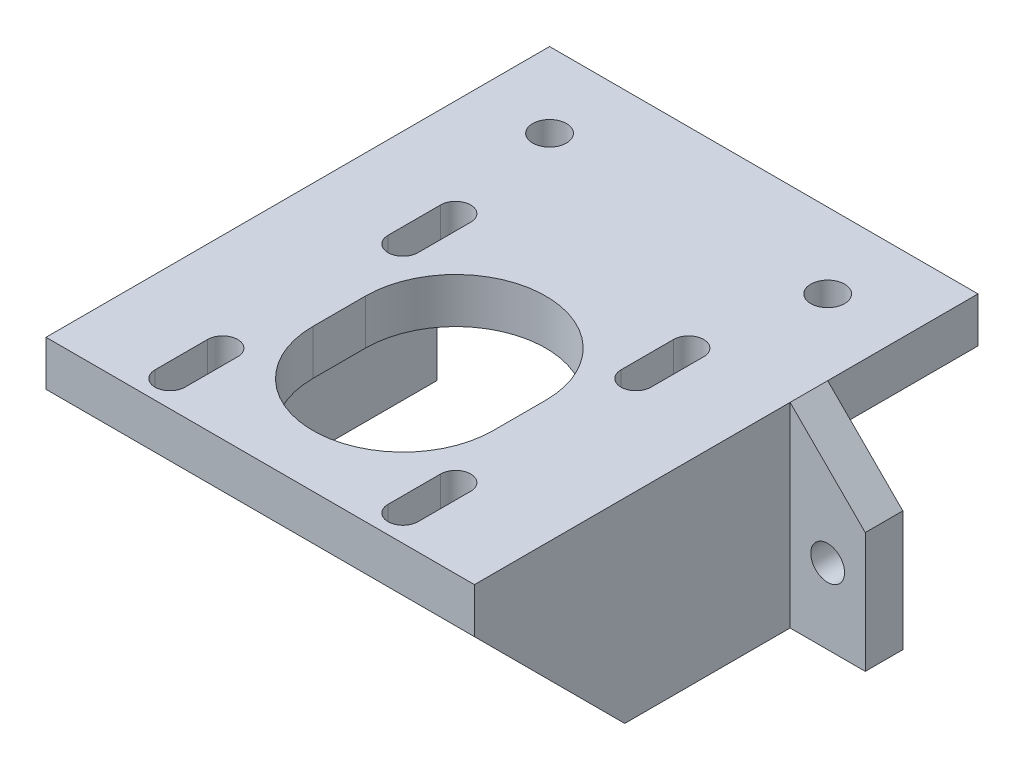
from build123d import *

# Parameters (mm, degrees)
SKETCH1_W           = 57
SKETCH1_H           = 6
BOSS_EXTRUDE1_DEPTH = 50
CUT_EXTRUDE2_DEPTH  = 10
SKETCH4_W           = 57
SKETCH4_H           = 6
BOSS_EXTRUDE2_DEPTH = 17
SKETCH6_R           = 2.25
CUT_EXTRUDE3_DEPTH  = 20
SKETCH8_W           = 5
SKETCH8_H           = 47
BOSS_EXTRUDE4_DEPTH = 20
CHAMFER1_SIZE       = 20
SKETCH9_W           = 5
SKETCH9_H           = 26
BOSS_EXTRUDE5_DEPTH = 10
SKETCH10_W          = 5
SKETCH10_H          = 26
BOSS_EXTRUDE6_DEPTH = 10
CHAMFER2_SIZE       = 10
SKETCH11_R          = 2.25
CUT_EXTRUDE4_DEPTH  = 10


with BuildPart() as part:
    # Sketch1 → Boss-Extrude1 (new body)
    with BuildSketch(Plane.XY):
        Rectangle(SKETCH1_W, SKETCH1_H)
    extrude(amount=BOSS_EXTRUDE1_DEPTH)

    # Sketch3 → Cut-Extrude2 (cut)
    with BuildSketch(Plane(origin=(0, 3, 0), x_dir=(1, 0, 0), z_dir=(0, 1, 0))):
        with BuildLine():
            Line((-13.5, -8.5), (-13.5, -15.5))
            ThreePointArc((-13.5, -15.5), (-15.5, -17.5), (-17.5, -15.5))
            Line((-17.5, -15.5), (-17.5, -8.5))
            ThreePointArc((-17.5, -8.5), (-15.5, -6.5), (-13.5, -8.5))
        make_face()
        with BuildLine():
            Line((-13.5, -39.5), (-13.5, -46.5))
            ThreePointArc((-13.5, -46.5), (-15.5, -48.5), (-17.5, -46.5))
            Line((-17.5, -46.5), (-17.5, -39.5))
            ThreePointArc((-17.5, -39.5), (-15.5, -37.5), (-13.5, -39.5))
        make_face()
        with BuildLine():
            Line((17.5, -39.5), (17.5, -46.5))
            ThreePointArc((17.5, -46.5), (15.5, -48.5), (13.5, -46.5))
            Line((13.5, -46.5), (13.5, -39.5))
            ThreePointArc((13.5, -39.5), (15.5, -37.5), (17.5, -39.5))
        make_face()
        with BuildLine():
            Line((17.5, -8.5), (17.5, -15.5))
            ThreePointArc((17.5, -15.5), (15.5, -17.5), (13.5, -15.5))
            Line((13.5, -15.5), (13.5, -8.5))
            ThreePointArc((13.5, -8.5), (15.5, -6.5), (17.5, -8.5))
        make_face()
        with BuildLine():
            Line((12, -24), (12, -31))
            ThreePointArc((12, -31), (0, -43), (-12, -31))
            Line((-12, -31), (-12, -24))
            ThreePointArc((-12, -24), (0, -12), (12, -24))
        make_face()
    extrude(amount=-CUT_EXTRUDE2_DEPTH, mode=Mode.SUBTRACT)

    # Sketch4 → Boss-Extrude2 (add)
    with BuildSketch(Plane(origin=(0, 0, 0), x_dir=(-1, 0, 0), z_dir=(0, 0, -1))):
        Rectangle(SKETCH4_W, SKETCH4_H)
    extrude(amount=BOSS_EXTRUDE2_DEPTH)

    # Sketch6 → Cut-Extrude3 (cut)
    with BuildSketch(Plane(origin=(0, 3, 0), x_dir=(1, 0, 0), z_dir=(0, 1, 0))):
        with Locations(Location((-18.5, 7, 0), (0, 0, 180))):
            Circle(SKETCH6_R)
        with Locations(Location((18.5, 7, 0), (0, 0, 180))):
            Circle(SKETCH6_R)
    extrude(amount=-CUT_EXTRUDE3_DEPTH, mode=Mode.SUBTRACT)

    # Sketch8 → Boss-Extrude4 (add)
    with BuildSketch(Plane.XZ.offset(3)):
        with Locations((-26, 26.5)):
            Rectangle(SKETCH8_W, SKETCH8_H)
        with Locations((26, 26.5)):
            Rectangle(SKETCH8_W, SKETCH8_H)
    extrude(amount=BOSS_EXTRUDE4_DEPTH)

    # Chamfer1
    chamfer1_edges = [part.edges().sort_by_distance(p)[0] for p in [
        (26, -23, 50),
        (-26, -23, 50),
    ]]
    chamfer(chamfer1_edges, length=CHAMFER1_SIZE)

    # Sketch9 → Boss-Extrude5 (add)
    with BuildSketch(Plane.ZY.offset(28.5)):
        with Locations((5.5, -10)):
            Rectangle(SKETCH9_W, SKETCH9_H)
    extrude(amount=BOSS_EXTRUDE5_DEPTH)

    # Sketch10 → Boss-Extrude6 (add)
    with BuildSketch(Plane(origin=(28.5, 0, 0), x_dir=(0, 0, -1), z_dir=(1, 0, 0))):
        with Locations((-5.5, -10)):
            Rectangle(SKETCH10_W, SKETCH10_H)
    extrude(amount=BOSS_EXTRUDE6_DEPTH)

    # Chamfer2
    chamfer2_edges = [part.edges().sort_by_distance(p)[0] for p in [
        (38.5, 3, 5.5),
        (-38.5, 3, 5.5),
    ]]
    chamfer(chamfer2_edges, length=CHAMFER2_SIZE)

    # Sketch11 → Cut-Extrude4 (cut)
    with BuildSketch(Plane.XY.offset(8)):
        with Locations((-33.5, -13)):
            Circle(SKETCH11_R)
        with Locations((33.5, -13)):
            Circle(SKETCH11_R)
    extrude(amount=-CUT_EXTRUDE4_DEPTH, mode=Mode.SUBTRACT)


solid = part.part
